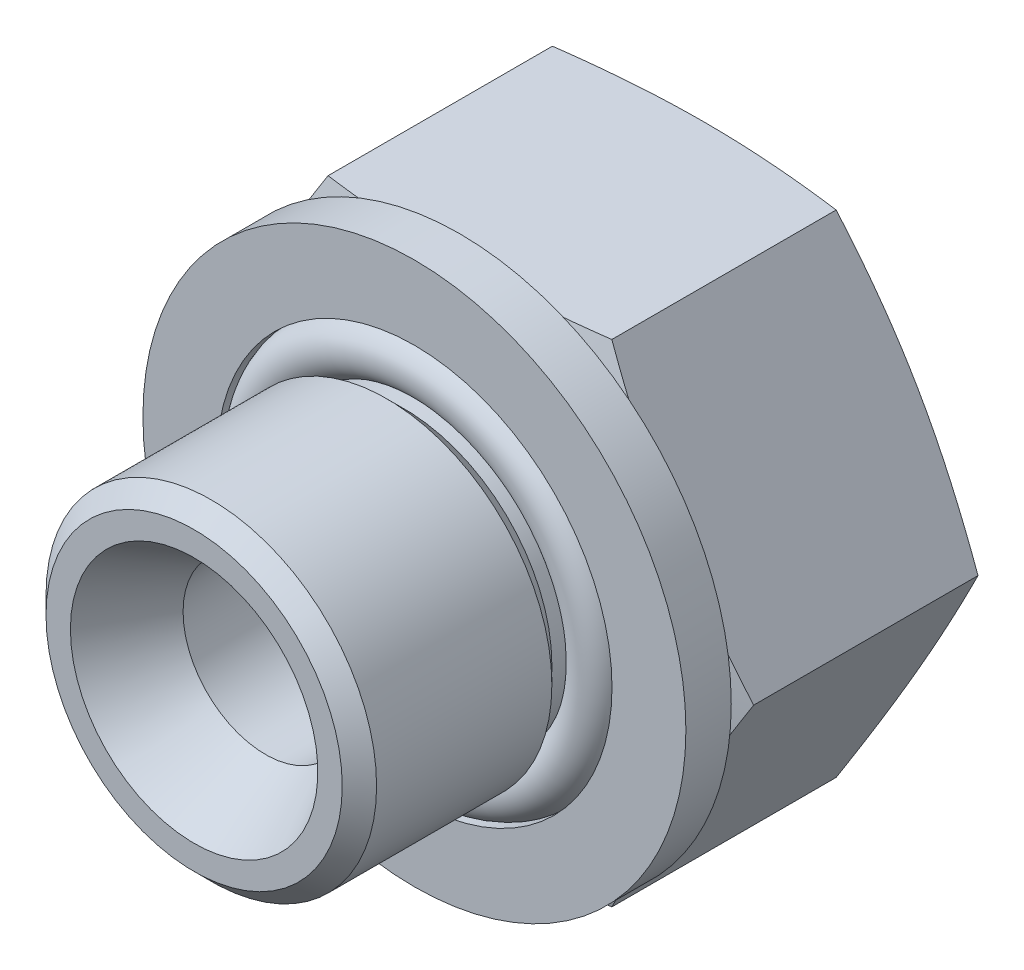
from build123d import *

# Parameters (mm, degrees)
SKETCH2_OUTSIDE_W  = 24.454
SKETCH2_OUTSIDE_H  = 24.454
EXTRUDE2_DEPTH     = 7.12
SKETCH3_W          = 0.76923077
SKETCH3_H          = 0.205128205
CUT_EXTRUDE1_DEPTH = 0.01
SKETCH4_W          = 1.32
SKETCH4_H          = 2.15
SKETCH5_R          = 0.765


with BuildPart() as part:
    # Sketch1 → Revolve1 (revolve)
    with BuildSketch(Plane(origin=(0, 0, 0), x_dir=(0, 0, -1), z_dir=(1, 0, 0)), mode=Mode.PRIVATE) as revolve1_sk:
        Polygon((0, 0), (0, 7.15), (-0.340295474, 8.42), (-6.779704526, 8.42), (-7.12, 7.15), (-7.12, 4.3), (-8.74, 4.3), (-9.25, 4.81), (-14.35, 4.81), (-14.85, 4.31), (-14.85, 3.6), (-12.771539031, 2.4), (-10.292065486, 2.4), (-8.85, 0), align=None)
    revolve(revolve1_sk.sketch.rotate(Axis((0, 0, 0), (0, 0, 1)), 90), axis=Axis((0, 0, 0), (0, 0, 1)))

    # Sketch2 outside → Extrude2 (cut)
    with BuildSketch(Plane(origin=(0, 0, 0), x_dir=(-1, 0, 0), z_dir=(0, 0, -1))):
        Rectangle(SKETCH2_OUTSIDE_W, SKETCH2_OUTSIDE_H)
        Polygon((-4.128054425, 7.15), (-8.256108849, 0), (-4.128054425, -7.15), (4.128054425, -7.15), (8.256108849, 0), (4.128054425, 7.15), align=None, mode=Mode.SUBTRACT)
    extrude(amount=-EXTRUDE2_DEPTH, mode=Mode.SUBTRACT)

    # Sketch3 → Cut-Extrude1 (cut)
    # profile 1 of 6: a face of its own
    with BuildSketch(Plane(origin=(0, 0, 0), x_dir=(-1, 0, 0), z_dir=(0, 0, -1))):
        with BuildLine():
            Line((-4.240655874, 0.385817308), (-4.071585361, 0.487179487))
            add(Edge.make_bspline(
                [(-4.071585361, 0.487179487), (-4.055860654, 0.460856981), (-4.025732722, 0.410424076), (-3.975474803, 0.342276625), (-3.923398853, 0.284355392), (-3.869119234, 0.236997331), (-3.812967264, 0.199712253), (-3.754576376, 0.173310977), (-3.694143341, 0.156844706), (-3.653015443, 0.154844656), (-3.632482797, 0.153846154)],
                knots=[0, 0, 0, 0, 1.272034388, 2.437168799, 3.508375237, 4.49857839, 5.41946034, 6.295179144, 7.148887113, 8, 8, 8, 8], degree=3))
            add(Edge.make_bspline(
                [(-3.632482797, 0.153846154), (-3.614947448, 0.154334538), (-3.580183578, 0.155302761), (-3.529005153, 0.164606077), (-3.479301266, 0.178898722), (-3.43209633, 0.199367825), (-3.388041693, 0.224132674), (-3.349409296, 0.254044776), (-3.316011517, 0.287534036), (-3.288692023, 0.324895553), (-3.267732003, 0.365076781), (-3.251622249, 0.406320182), (-3.242682207, 0.449273649), (-3.241335491, 0.478193914), (-3.240655874, 0.492788462)],
                knots=[0, 0, 0, 0, 1.095163259, 2.171163733, 3.241058638, 4.321873601, 5.38011039, 6.391990106, 7.366004449, 8.327778327, 9.272591725, 10.192022065, 11.087607919, 12, 12, 12, 12], degree=3))
            add(Edge.make_bspline(
                [(-3.240655874, 0.492788462), (-3.241498337, 0.509440376), (-3.243210942, 0.543291284), (-3.257686073, 0.593233943), (-3.280457071, 0.642658268), (-3.301464296, 0.67323042), (-3.312370617, 0.689102564)],
                knots=[0, 0, 0, 0, 0.938893495, 1.908633276, 2.914225137, 4, 4, 4, 4], degree=3))
            add(Edge.make_bspline(
                [(-3.312370617, 0.689102564), (-3.321325254, 0.700557892), (-3.340124394, 0.72460692), (-3.372442972, 0.760404197), (-3.410366466, 0.797329008), (-3.452597069, 0.836791326), (-3.50067312, 0.876955781), (-3.553088842, 0.919737654), (-3.611182476, 0.963509984), (-3.651925045, 0.992865736), (-3.67294754, 1.008012821)],
                knots=[0, 0, 0, 0, 0.722233717, 1.516239348, 2.393582979, 3.351407094, 4.387010283, 5.505090956, 6.712668013, 8, 8, 8, 8], degree=3))
            add(Edge.make_bspline(
                [(-3.67294754, 1.008012821), (-3.693989824, 1.023000585), (-3.734221068, 1.051656049), (-3.790483115, 1.094184211), (-3.840794236, 1.133066422), (-3.884930817, 1.168668715), (-3.922873444, 1.200995918), (-3.954921108, 1.229737597), (-3.980257426, 1.255671061), (-3.994346329, 1.272494685), (-4.000671899, 1.280048077)],
                knots=[0, 0, 0, 0, 1.452282411, 2.77665338, 3.964542531, 5.026858415, 5.96415736, 6.766646006, 7.446254459, 8, 8, 8, 8], degree=3))
            add(Edge.make_bspline(
                [(-4.000671899, 1.280048077), (-4.009513354, 1.291820098), (-4.026901261, 1.314971357), (-4.049853264, 1.35115699), (-4.069361357, 1.388198856), (-4.084654118, 1.426196493), (-4.097531957, 1.464616452), (-4.106193632, 1.503960021), (-4.111617287, 1.544050661), (-4.112172708, 1.571029804), (-4.112450746, 1.584535256)],
                knots=[0, 0, 0, 0, 1.068054152, 2.10047183, 3.106115577, 4.101338837, 5.06977816, 6.043150881, 7.020423561, 8, 8, 8, 8], degree=3))
            add(Edge.make_bspline(
                [(-4.112450746, 1.584535256), (-4.111704912, 1.605695128), (-4.110229186, 1.647562593), (-4.097748891, 1.708723067), (-4.078050094, 1.767115306), (-4.050453015, 1.822161211), (-4.014877385, 1.872427485), (-3.973708257, 1.918492335), (-3.924673122, 1.957217239), (-3.870871623, 1.991052701), (-3.811982267, 2.017536087), (-3.75027318, 2.03751379), (-3.685646281, 2.048833366), (-3.641873062, 2.050457803), (-3.619662284, 2.051282051)],
                knots=[0, 0, 0, 0, 1.005424448, 1.989358655, 2.955360095, 3.929531133, 4.905563448, 5.876582895, 6.856512386, 7.866279853, 8.892233794, 9.918561126, 10.94386622, 12, 12, 12, 12], degree=3))
            add(Edge.make_bspline(
                [(-3.619662284, 2.051282051), (-3.596094227, 2.050469165), (-3.549224883, 2.048852593), (-3.480282474, 2.03479686), (-3.413904922, 2.011539334), (-3.36050877, 1.985145815), (-3.318718621, 1.958785006), (-3.286848488, 1.934773678), (-3.254552802, 1.907130758), (-3.221571056, 1.875782618), (-3.188462108, 1.840441617), (-3.154734421, 1.801349795), (-3.120309125, 1.758746049), (-3.098162919, 1.728332048), (-3.08680972, 1.712740385)],
                knots=[0, 0, 0, 0, 1.286793592, 2.559021753, 3.825965368, 5.121522368, 5.803751409, 6.523245864, 7.299691795, 8.125521123, 9.008227632, 9.944561021, 10.946284179, 12, 12, 12, 12], degree=3))
            Line((-3.08680972, 1.712740385), (-3.249069335, 1.58974359))
            add(Edge.make_bspline(
                [(-3.249069335, 1.58974359), (-3.258867011, 1.602365699), (-3.277735044, 1.626672929), (-3.306380465, 1.660713681), (-3.333379692, 1.691808812), (-3.35997992, 1.718817456), (-3.384776281, 1.743218676), (-3.408843163, 1.764109965), (-3.43183422, 1.78169602), (-3.460815312, 1.800463768), (-3.497225437, 1.819067485), (-3.542930886, 1.834809815), (-3.590694472, 1.84426985), (-3.62322569, 1.845520643), (-3.639694335, 1.846153846)],
                knots=[0, 0, 0, 0, 1.181633172, 2.275549214, 3.290209073, 4.226197932, 5.078386478, 5.862611352, 6.581680152, 7.217281963, 8.414376989, 9.595101626, 10.782541182, 12, 12, 12, 12], degree=3))
            add(Edge.make_bspline(
                [(-3.639694335, 1.846153846), (-3.660355205, 1.845461446), (-3.700197747, 1.844126218), (-3.756763596, 1.829543369), (-3.80767441, 1.806582306), (-3.851418733, 1.774402319), (-3.887839863, 1.736276037), (-3.914185839, 1.692402406), (-3.930043076, 1.643955319), (-3.931978093, 1.610160086), (-3.932963566, 1.592948718)],
                knots=[0, 0, 0, 0, 1.14458467, 2.207223713, 3.21896685, 4.227309161, 5.202851033, 6.127160689, 7.046193047, 8, 8, 8, 8], degree=3))
            add(Edge.make_bspline(
                [(-3.932963566, 1.592948718), (-3.932738922, 1.582233587), (-3.932289267, 1.560785805), (-3.926017954, 1.529099278), (-3.917961195, 1.497492798), (-3.905193977, 1.466108465), (-3.887568089, 1.434397403), (-3.864422274, 1.401813553), (-3.83527181, 1.368069719), (-3.812942089, 1.346122649), (-3.801152669, 1.334535256)],
                knots=[0, 0, 0, 0, 0.858281714, 1.717966888, 2.583508476, 3.4729293, 4.427298488, 5.488583878, 6.674047936, 8, 8, 8, 8], degree=3))
            add(Edge.make_bspline(
                [(-3.801152669, 1.334535256), (-3.796774742, 1.330628385), (-3.786373789, 1.321346551), (-3.767358974, 1.306150962), (-3.742248804, 1.287406521), (-3.711698975, 1.264213769), (-3.675146196, 1.237310076), (-3.63258645, 1.207039441), (-3.584494146, 1.172419178), (-3.550367336, 1.148214869), (-3.53232254, 1.135416667)],
                knots=[0, 0, 0, 0, 0.420754252, 0.999615792, 1.744751191, 2.668019286, 3.750313428, 4.999500688, 6.413464383, 8, 8, 8, 8], degree=3))
            add(Edge.make_bspline(
                [(-3.53232254, 1.135416667), (-3.510616304, 1.119621604), (-3.468585186, 1.089036654), (-3.408780855, 1.043084837), (-3.354555822, 0.998143255), (-3.305719705, 0.954498908), (-3.261790043, 0.912482855), (-3.223254203, 0.871589609), (-3.189719529, 0.832112139), (-3.153617118, 0.781499239), (-3.116726935, 0.719338619), (-3.085046074, 0.643179626), (-3.065069876, 0.566724586), (-3.062457581, 0.515337822), (-3.061168694, 0.489983974)],
                knots=[0, 0, 0, 0, 1.163667725, 2.253281268, 3.268753668, 4.215851969, 5.092017293, 5.902905408, 6.650798638, 7.335211899, 8.59617414, 9.77448103, 10.901945474, 12, 12, 12, 12], degree=3))
            add(Edge.make_bspline(
                [(-3.061168694, 0.489983974), (-3.061544202, 0.47205348), (-3.062287925, 0.436540689), (-3.070837018, 0.384394931), (-3.083362541, 0.33374872), (-3.102240961, 0.285228084), (-3.125282765, 0.237945363), (-3.154520621, 0.193140848), (-3.188410727, 0.149822906), (-3.227287164, 0.109146625), (-3.26982768, 0.071805942), (-3.314789791, 0.038589335), (-3.36224709, 0.010893151), (-3.411942128, -0.011707331), (-3.46388632, -0.029383626), (-3.518062197, -0.04219098), (-3.57455906, -0.050051386), (-3.612959335, -0.05086725), (-3.632482797, -0.051282051)],
                knots=[0, 0, 0, 0, 0.983748083, 1.948392443, 2.894712957, 3.844097841, 4.80183111, 5.778335162, 6.776009319, 7.81870978, 8.863265674, 9.881300176, 10.883814829, 11.87499822, 12.874611388, 13.892143829, 14.928324115, 16, 16, 16, 16], degree=3))
            add(Edge.make_bspline(
                [(-3.632482797, -0.051282051), (-3.647588707, -0.050989948), (-3.677610284, -0.050409419), (-3.722015702, -0.045277258), (-3.765524039, -0.038016056), (-3.807589343, -0.026488016), (-3.848753578, -0.012501172), (-3.888837712, 0.004720732), (-3.927861172, 0.025359133), (-3.966042648, 0.04895629), (-4.003285033, 0.076417858), (-4.039239015, 0.108402713), (-4.075084264, 0.144028716), (-4.109762776, 0.184263324), (-4.143976001, 0.228456514), (-4.177049378, 0.277021761), (-4.209667502, 0.329694535), (-4.230133484, 0.366760298), (-4.240655874, 0.385817308)],
                knots=[0, 0, 0, 0, 0.915332311, 1.819136955, 2.706846663, 3.586547465, 4.459518054, 5.340707479, 6.227863349, 7.133153174, 8.059268498, 9.028702269, 10.047606654, 11.120612155, 12.245963614, 13.433783089, 14.680604001, 16, 16, 16, 16], degree=3))
        make_face()
    # profile 2 of 6: a face of its own
    with BuildSketch(Plane(origin=(0, 0, 0), x_dir=(-1, 0, 0), z_dir=(0, 0, -1))):
        Polygon((-2.702194335, 2), (-1.471425105, 2), (-2.522707156, -0.051282051), (-2.677755233, 0.034054487), (-1.775111002, 1.794871795), (-2.702194335, 1.794871795), align=None)
    # profile 3 of 6: a face of its own
    with BuildSketch(Plane(origin=(0, 0, 0), x_dir=(-1, 0, 0), z_dir=(0, 0, -1))):
        with BuildLine():
            Line((-1.035527669, 1.538461538), (-1.215014848, 1.538461538))
            add(Edge.make_bspline(
                [(-1.215014848, 1.538461538), (-1.210152248, 1.558594386), (-1.200646262, 1.597952458), (-1.180819077, 1.654185178), (-1.159219502, 1.707398619), (-1.133282871, 1.756596375), (-1.104992155, 1.802767177), (-1.072579171, 1.844863819), (-1.037539329, 1.883956942), (-0.998782215, 1.918650221), (-0.958137266, 1.950066066), (-0.915031769, 1.976851813), (-0.870332973, 1.999894186), (-0.823731182, 2.018877176), (-0.775087656, 2.033177475), (-0.724842157, 2.043552793), (-0.672863014, 2.050290572), (-0.637578676, 2.050948151), (-0.619662284, 2.051282051)],
                knots=[0, 0, 0, 0, 1.162005537, 2.271625781, 3.343758855, 4.383309926, 5.390229558, 6.379919256, 7.361854164, 8.333198761, 9.295911338, 10.242430842, 11.177959212, 12.116337295, 13.062827104, 14.020064771, 14.994644689, 16, 16, 16, 16], degree=3))
            add(Edge.make_bspline(
                [(-0.619662284, 2.051282051), (-0.59355786, 2.05049392), (-0.541918425, 2.048934848), (-0.466053827, 2.034698027), (-0.392895645, 2.01216938), (-0.323244646, 1.981041536), (-0.258548399, 1.942648786), (-0.200984863, 1.89695465), (-0.151334286, 1.844840764), (-0.109680356, 1.787279298), (-0.07706607, 1.725761864), (-0.053016714, 1.662447489), (-0.038375754, 1.597486362), (-0.036478293, 1.55362506), (-0.035527669, 1.531650641)],
                knots=[0, 0, 0, 0, 1.083050992, 2.142477498, 3.193116406, 4.255571735, 5.30263384, 6.308962982, 7.297363603, 8.282367274, 9.249857812, 10.179914175, 11.08814088, 12, 12, 12, 12], degree=3))
            add(Edge.make_bspline(
                [(-0.035527669, 1.531650641), (-0.036192578, 1.510503901), (-0.037493702, 1.469123013), (-0.048541534, 1.408710729), (-0.067133684, 1.351772672), (-0.092887834, 1.29806915), (-0.126225863, 1.24794067), (-0.166610261, 1.201274447), (-0.214326068, 1.1578635), (-0.250485461, 1.132995229), (-0.269101387, 1.120192308)],
                knots=[0, 0, 0, 0, 1.024540389, 2.004866551, 2.965041327, 3.920577974, 4.882998113, 5.874504559, 6.905732034, 8, 8, 8, 8], degree=3))
            add(Edge.make_bspline(
                [(-0.269101387, 1.120192308), (-0.247826098, 1.109919067), (-0.205673599, 1.089564805), (-0.148216153, 1.04964723), (-0.096057367, 1.003557888), (-0.066969528, 0.967590658), (-0.052354592, 0.949519231)],
                knots=[0, 0, 0, 0, 1.015518401, 2.012035669, 3.001164323, 4, 4, 4, 4], degree=3))
            add(Edge.make_bspline(
                [(-0.052354592, 0.949519231), (-0.042730967, 0.936343373), (-0.023641313, 0.91020742), (-7.815e-05, 0.868186606), (0.021298486, 0.82570004), (0.037955754, 0.781608951), (0.050855107, 0.736424372), (0.060075697, 0.690068717), (0.065803777, 0.642504133), (0.066624093, 0.610325573), (0.067036434, 0.594150641)],
                knots=[0, 0, 0, 0, 1.025084078, 2.033381695, 3.024893161, 4.013698104, 4.991890475, 5.976764909, 6.982997093, 8, 8, 8, 8], degree=3))
            add(Edge.make_bspline(
                [(0.067036434, 0.594150641), (0.066010998, 0.566145086), (0.063964951, 0.510265771), (0.045676908, 0.427708787), (0.017326485, 0.3470085), (-0.022934621, 0.269822877), (-0.072001769, 0.197605517), (-0.130377383, 0.132990483), (-0.197398188, 0.077448424), (-0.272144273, 0.031042579), (-0.353125489, -0.006053377), (-0.439740113, -0.031800487), (-0.530740144, -0.048569629), (-0.593144314, -0.05036784), (-0.624870617, -0.051282051)],
                knots=[0, 0, 0, 0, 0.955779014, 1.907060117, 2.875433937, 3.871313158, 4.872415639, 5.851225146, 6.836215519, 7.83643374, 8.849228613, 9.86973379, 10.916971861, 12, 12, 12, 12], degree=3))
            add(Edge.make_bspline(
                [(-0.624870617, -0.051282051), (-0.646253075, -0.050785929), (-0.68832662, -0.049809727), (-0.750180048, -0.043136241), (-0.809221019, -0.030947666), (-0.865529361, -0.014545777), (-0.919155096, 0.006249504), (-0.969934585, 0.032145903), (-1.018180238, 0.062609618), (-1.063436781, 0.09800024), (-1.10569882, 0.137589577), (-1.143843234, 0.18208044), (-1.178505973, 0.230650385), (-1.208758909, 0.28386356), (-1.235980025, 0.341032278), (-1.258369143, 0.402888563), (-1.278075182, 0.468879433), (-1.287237162, 0.514866713), (-1.291937925, 0.538461538)],
                knots=[0, 0, 0, 0, 1.048658725, 2.063410685, 3.046034179, 4.001477787, 4.936774919, 5.862367409, 6.792675028, 7.730719943, 8.675894397, 9.627829632, 10.600096036, 11.597688215, 12.626045268, 13.701542398, 14.82072376, 16, 16, 16, 16], degree=3))
            Line((-1.291937925, 0.538461538), (-1.112450746, 0.538461538))
            add(Edge.make_bspline(
                [(-1.112450746, 0.538461538), (-1.107774579, 0.523062102), (-1.098679029, 0.493108861), (-1.083196573, 0.450000115), (-1.06555756, 0.410481228), (-1.046634955, 0.374262301), (-1.026761558, 0.340986642), (-1.004524458, 0.311534146), (-0.98157066, 0.284611173), (-0.964268173, 0.269442823), (-0.955800105, 0.262019231)],
                knots=[0, 0, 0, 0, 1.198163088, 2.33053128, 3.407730985, 4.417276592, 5.372219308, 6.28897303, 7.162600585, 8, 8, 8, 8], degree=3))
            add(Edge.make_bspline(
                [(-0.955800105, 0.262019231), (-0.944602061, 0.253385897), (-0.922240539, 0.236145879), (-0.88580155, 0.214144948), (-0.847478758, 0.195081505), (-0.806441801, 0.180519393), (-0.763576218, 0.168189302), (-0.718189152, 0.160120434), (-0.670681028, 0.154584336), (-0.638242306, 0.154095803), (-0.621665489, 0.153846154)],
                knots=[0, 0, 0, 0, 0.946170439, 1.889420265, 2.845303464, 3.807233317, 4.801018734, 5.828864929, 6.890507805, 8, 8, 8, 8], degree=3))
            add(Edge.make_bspline(
                [(-0.621665489, 0.153846154), (-0.602949202, 0.1541981), (-0.566351118, 0.154886299), (-0.512948341, 0.161215275), (-0.462144085, 0.170432654), (-0.414502414, 0.184668644), (-0.369399267, 0.202257702), (-0.327466895, 0.224342505), (-0.288154835, 0.250253775), (-0.251966603, 0.279704722), (-0.219426313, 0.311945577), (-0.190775163, 0.345667332), (-0.166418213, 0.380727806), (-0.146770454, 0.417321018), (-0.131255854, 0.455295434), (-0.120694025, 0.494757622), (-0.113350302, 0.535384632), (-0.112752238, 0.563001185), (-0.112450746, 0.576923077)],
                knots=[0, 0, 0, 0, 1.217147791, 2.380027433, 3.494444702, 4.572153297, 5.609568379, 6.639424714, 7.649109417, 8.668170816, 9.669597737, 10.625200337, 11.543417969, 12.441394052, 13.322311151, 14.205496177, 15.095365482, 16, 16, 16, 16], degree=3))
            add(Edge.make_bspline(
                [(-0.112450746, 0.576923077), (-0.113325204, 0.595558128), (-0.115069768, 0.632735504), (-0.128388957, 0.687431261), (-0.150296879, 0.740130353), (-0.180966886, 0.789933662), (-0.218301588, 0.83609132), (-0.261938677, 0.877275024), (-0.312240522, 0.911257933), (-0.35853759, 0.934737166), (-0.399546251, 0.950758352), (-0.434640756, 0.96142976), (-0.473930244, 0.970466134), (-0.516939586, 0.978873147), (-0.563992853, 0.986028203), (-0.615038817, 0.991994955), (-0.670087824, 0.996769264), (-0.708197062, 0.998901318), (-0.727835361, 1)],
                knots=[0, 0, 0, 0, 1.07054697, 2.135767047, 3.216561865, 4.33974944, 5.486079747, 6.621378074, 7.775625952, 8.963672916, 9.598146892, 10.304877434, 11.070270905, 11.915000392, 12.823868403, 13.805723172, 14.86925407, 16, 16, 16, 16], degree=3))
            Line((-0.727835361, 1), (-0.727835361, 1.205128205))
            add(Edge.make_bspline(
                [(-0.727835361, 1.205128205), (-0.703091838, 1.205548093), (-0.654625354, 1.20637055), (-0.583828608, 1.216317985), (-0.516129573, 1.230078344), (-0.453028577, 1.251155596), (-0.395515027, 1.275635766), (-0.345618111, 1.304122743), (-0.304036884, 1.335788314), (-0.270973415, 1.371121233), (-0.24609957, 1.409015546), (-0.227912829, 1.448510779), (-0.217169785, 1.4899531), (-0.21573569, 1.518235767), (-0.215014848, 1.532451923)],
                knots=[0, 0, 0, 0, 1.321986639, 2.589447074, 3.816329219, 5.01088745, 6.139805852, 7.153945165, 8.075214402, 8.924034688, 9.728124013, 10.488707548, 11.240355623, 12, 12, 12, 12], degree=3))
            add(Edge.make_bspline(
                [(-0.215014848, 1.532451923), (-0.215251654, 1.542896349), (-0.215722769, 1.563675039), (-0.221664071, 1.594032221), (-0.230592094, 1.623461333), (-0.242866225, 1.651837224), (-0.25929491, 1.678963095), (-0.278955474, 1.705070209), (-0.302365817, 1.730009511), (-0.329191787, 1.753255408), (-0.357998532, 1.775409258), (-0.389569832, 1.79421705), (-0.422953761, 1.810299943), (-0.458187278, 1.823562516), (-0.495384724, 1.833539252), (-0.534371328, 1.84070259), (-0.575221433, 1.845181249), (-0.603090994, 1.845826059), (-0.617258438, 1.846153846)],
                knots=[0, 0, 0, 0, 0.884392785, 1.759457502, 2.611959086, 3.489218968, 4.37281399, 5.2945488, 6.255912374, 7.266815255, 8.301784654, 9.332968512, 10.37626691, 11.440494194, 12.520033166, 13.637162961, 14.798855837, 16, 16, 16, 16], degree=3))
            add(Edge.make_bspline(
                [(-0.617258438, 1.846153846), (-0.64003082, 1.845358782), (-0.684510578, 1.843805837), (-0.748633387, 1.830204115), (-0.808244435, 1.808502353), (-0.853809388, 1.782597771), (-0.887456573, 1.757026094), (-0.911500537, 1.734693302), (-0.935112258, 1.709874546), (-0.956738359, 1.681041188), (-0.978609203, 1.65014588), (-0.998520381, 1.615618062), (-1.017868776, 1.578358408), (-1.029527376, 1.552018045), (-1.035527669, 1.538461538)],
                knots=[0, 0, 0, 0, 1.472543308, 2.876219568, 4.221790263, 5.565193594, 6.249813518, 6.953379497, 7.687249741, 8.463570142, 9.283606569, 10.136032583, 11.040678096, 12, 12, 12, 12], degree=3))
        make_face()
    # profile 4 of 6: a face of its own
    with BuildSketch(Plane(origin=(0, 0, 0), x_dir=(-1, 0, 0), z_dir=(0, 0, -1))):
        with Locations((0.631138998, 0.76923077)):
            Rectangle(SKETCH3_W, SKETCH3_H)
    # profile 5 of 6: a face of its own
    with BuildSketch(Plane(origin=(0, 0, 0), x_dir=(-1, 0, 0), z_dir=(0, 0, -1))):
        with BuildLine():
            add(Edge.make_bspline(
                [(1.169600537, 0.999198718), (1.169787975, 1.031254368), (1.170152078, 1.093522931), (1.174202605, 1.184257012), (1.180931372, 1.269377177), (1.190152728, 1.3488875), (1.20137443, 1.422808509), (1.216354709, 1.490942656), (1.233390596, 1.553605288), (1.253134851, 1.611000744), (1.275413587, 1.663902289), (1.299661736, 1.713288118), (1.326841619, 1.759083508), (1.355399855, 1.802019388), (1.386492467, 1.841392928), (1.419234633, 1.877760164), (1.454904276, 1.910280593), (1.492288853, 1.939907051), (1.531726832, 1.965878178), (1.57209407, 1.988754028), (1.613668416, 2.00829681), (1.656563378, 2.023662773), (1.700393411, 2.036354686), (1.745311735, 2.045034084), (1.791392514, 2.050495175), (1.822496191, 2.051017271), (1.838270408, 2.051282051)],
                knots=[0, 0, 0, 0, 1.646270934, 3.197905019, 4.663502075, 6.030701355, 7.308322542, 8.50163776, 9.611534131, 10.641858119, 11.616356847, 12.558055219, 13.465016945, 14.349605745, 15.204443733, 16.039544428, 16.859896111, 17.680448484, 18.487036065, 19.28249412, 20.06191084, 20.843045899, 21.620316918, 22.403196591, 23.190181807, 24, 24, 24, 24], degree=3))
            add(Edge.make_bspline(
                [(1.838270408, 2.051282051), (1.854176396, 2.0510033), (1.885808401, 2.050448951), (1.93257433, 2.045120984), (1.978259862, 2.036280342), (2.022670227, 2.023754071), (2.066170219, 2.008213684), (2.108419595, 1.988735331), (2.149680785, 1.966061693), (2.189298092, 1.939419477), (2.227706444, 1.909715319), (2.263962422, 1.876136651), (2.298069329, 1.839022526), (2.330455217, 1.798770032), (2.360201273, 1.754607127), (2.388528949, 1.707301921), (2.413884398, 1.656027141), (2.438304212, 1.601638303), (2.45938249, 1.542630498), (2.478391773, 1.479336349), (2.493751184, 1.411008242), (2.506545054, 1.338004673), (2.516456423, 1.26005754), (2.523675075, 1.177333931), (2.527488267, 1.089779422), (2.528206382, 1.029917794), (2.528574895, 0.999198718)],
                knots=[0, 0, 0, 0, 0.810914788, 1.612654377, 2.396697861, 3.181598691, 3.963628158, 4.749916497, 5.551656086, 6.361998678, 7.18212741, 8.025565596, 8.878627764, 9.750805457, 10.657531673, 11.591944965, 12.560506719, 13.57287815, 14.630710178, 15.753379473, 16.941251878, 18.199788006, 19.531962791, 20.947069417, 22.433333509, 24, 24, 24, 24], degree=3))
            add(Edge.make_bspline(
                [(2.528574895, 0.999198718), (2.528202561, 0.968613628), (2.527477084, 0.909019827), (2.523717823, 0.821859269), (2.516312891, 0.739574673), (2.50705004, 0.661968695), (2.494220919, 0.589364341), (2.478446538, 0.52151037), (2.460932068, 0.458113758), (2.439312185, 0.399693866), (2.415648922, 0.345435738), (2.389903096, 0.294768796), (2.362320338, 0.247245201), (2.332269627, 0.203245345), (2.300239105, 0.162457541), (2.265543225, 0.125601757), (2.229160034, 0.091789944), (2.190638654, 0.0617033), (2.150403481, 0.035369126), (2.109284009, 0.011818354), (2.066550647, -0.007171757), (2.023171817, -0.023477495), (1.978527036, -0.035934896), (1.932671956, -0.044548528), (1.885839821, -0.050589584), (1.854181784, -0.05105043), (1.838270408, -0.051282051)],
                knots=[0, 0, 0, 0, 1.561518951, 3.042555995, 4.452378317, 5.7783523, 7.031515105, 8.214008947, 9.334062868, 10.386615937, 11.391082383, 12.354592575, 13.286541444, 14.194233754, 15.072674879, 15.931287219, 16.775624067, 17.606195743, 18.42308326, 19.229000347, 20.022332153, 20.807536673, 21.593273796, 22.3848459, 23.188221202, 24, 24, 24, 24], degree=3))
            add(Edge.make_bspline(
                [(1.838270408, -0.051282051), (1.822496629, -0.051015562), (1.791393815, -0.050490098), (1.745306714, -0.04505368), (1.70057389, -0.036313393), (1.656974602, -0.024075333), (1.614285164, -0.009095427), (1.573087286, 0.010420964), (1.532922896, 0.032897574), (1.493899149, 0.058494958), (1.456749343, 0.087821634), (1.421264426, 0.120258371), (1.388335843, 0.156614606), (1.357687789, 0.196316276), (1.328559738, 0.238998129), (1.301765811, 0.285242913), (1.276982466, 0.334867262), (1.254329042, 0.388191783), (1.234244092, 0.445994599), (1.216502544, 0.508936986), (1.202494454, 0.577574493), (1.190504194, 0.651355845), (1.180833118, 0.730598091), (1.174230646, 0.81534425), (1.170149895, 0.905541512), (1.169786998, 0.967409955), (1.169600537, 0.999198718)],
                knots=[0, 0, 0, 0, 0.810891512, 1.598919785, 2.382837074, 3.152667961, 3.926044502, 4.706494248, 5.493654104, 6.291793342, 7.103789334, 7.925228297, 8.761435821, 9.622817696, 10.50288917, 11.416980706, 12.369136599, 13.353924996, 14.394355917, 15.514179734, 16.714354668, 17.994756427, 19.357759367, 20.818452758, 22.365282078, 24, 24, 24, 24], degree=3))
        make_face()
        with BuildLine():
            add(Edge.make_bspline(
                [(1.349087716, 1), (1.349155971, 0.973286458), (1.349288442, 0.921440718), (1.352749128, 0.846101712), (1.357463546, 0.775832952), (1.363544287, 0.710545217), (1.372574544, 0.650459496), (1.382692708, 0.595162534), (1.395005902, 0.54494697), (1.409574484, 0.499468221), (1.426168254, 0.457954468), (1.44428589, 0.419325202), (1.46374916, 0.383124095), (1.485531532, 0.349676319), (1.509254425, 0.318872797), (1.534382002, 0.290168321), (1.56185205, 0.264570046), (1.599854189, 0.233868986), (1.650023603, 0.202143767), (1.713235291, 0.17451743), (1.778188692, 0.157156026), (1.82227512, 0.154948165), (1.844280024, 0.153846154)],
                knots=[0, 0, 0, 0, 1.459021318, 2.831673884, 4.118529203, 5.306027144, 6.411944654, 7.436330062, 8.375795394, 9.233974572, 10.042671642, 10.816086306, 11.563610507, 12.285937304, 12.993564865, 13.685989202, 14.367179055, 15.041617293, 16.353048772, 17.594441528, 18.799311195, 20, 20, 20, 20], degree=3))
            add(Edge.make_bspline(
                [(1.844280024, 0.153846154), (1.866427265, 0.154759171), (1.910676021, 0.156583322), (1.975323904, 0.1741826), (2.038084058, 0.200736623), (2.087268024, 0.232135197), (2.12468662, 0.2620371), (2.151496329, 0.287531184), (2.176103214, 0.316077394), (2.199441542, 0.346876992), (2.220846728, 0.380518412), (2.240311378, 0.416839883), (2.258073291, 0.455942271), (2.268192746, 0.483239264), (2.273366562, 0.497195513)],
                knots=[0, 0, 0, 0, 1.353760809, 2.704726607, 4.075137775, 5.516104923, 6.260822281, 7.007110065, 7.778089737, 8.566572457, 9.372053459, 10.217411131, 11.088608312, 12, 12, 12, 12], degree=3))
            add(Edge.make_bspline(
                [(2.273366562, 0.497195513), (2.279396144, 0.515041078), (2.29163878, 0.551275229), (2.307416937, 0.60748303), (2.319842879, 0.666456038), (2.331021945, 0.727841819), (2.338652263, 0.792093077), (2.344793871, 0.859011011), (2.348411406, 0.928646075), (2.348859835, 0.975957498), (2.349087716, 1)],
                knots=[0, 0, 0, 0, 0.884706709, 1.796334032, 2.740027952, 3.714592787, 4.726048262, 5.777819803, 6.87074269, 8, 8, 8, 8], degree=3))
            add(Edge.make_bspline(
                [(2.349087716, 1), (2.348773322, 1.024038613), (2.348158301, 1.071063278), (2.34580745, 1.13993081), (2.339736836, 1.205340959), (2.332994483, 1.267575515), (2.323053214, 1.326289974), (2.312334467, 1.381975863), (2.297933774, 1.433943305), (2.282551046, 1.483005923), (2.264945105, 1.528606297), (2.245564686, 1.570957033), (2.224866538, 1.61026259), (2.202385258, 1.646415128), (2.178387724, 1.679576581), (2.152240553, 1.709082063), (2.124980912, 1.735846045), (2.086799663, 1.766396085), (2.036814354, 1.797545625), (1.974616842, 1.826211773), (1.909890759, 1.842673655), (1.8661345, 1.844994619), (1.844280024, 1.846153846)],
                knots=[0, 0, 0, 0, 1.31362396, 2.569729283, 3.763502607, 4.902122613, 5.988968491, 7.01645872, 7.998833611, 8.933434873, 9.825090667, 10.667526885, 11.477055099, 12.250526234, 12.991942729, 13.710640831, 14.402115721, 15.076753259, 16.378508321, 17.609869233, 18.806226677, 20, 20, 20, 20], degree=3))
            add(Edge.make_bspline(
                [(1.844280024, 1.846153846), (1.822159685, 1.844993019), (1.777878711, 1.842669251), (1.712479879, 1.826273107), (1.649791679, 1.797694269), (1.59993855, 1.766292913), (1.561730672, 1.736385307), (1.534826276, 1.71045019), (1.509599892, 1.682080902), (1.486361206, 1.650994093), (1.464595901, 1.617585312), (1.444606751, 1.581591732), (1.426596849, 1.542830953), (1.409977114, 1.501335847), (1.395364092, 1.455861021), (1.383310399, 1.405707311), (1.37217494, 1.35058623), (1.364291929, 1.290175082), (1.357284068, 1.224870995), (1.352780441, 1.154426813), (1.349276865, 1.078961452), (1.349152029, 1.026847648), (1.349087716, 1)],
                knots=[0, 0, 0, 0, 1.207732386, 2.417664972, 3.655092373, 4.956220595, 5.625982001, 6.301752483, 6.994047911, 7.697131622, 8.419323945, 9.170223765, 9.943494443, 10.752040957, 11.610060368, 12.549350801, 13.567764191, 14.679664412, 15.874934091, 17.154273443, 18.533957287, 20, 20, 20, 20], degree=3))
        make_face(mode=Mode.SUBTRACT)
    # profile 6 of 6: a face of its own
    with BuildSketch(Plane(origin=(0, 0, 0), x_dir=(-1, 0, 0), z_dir=(0, 0, -1))):
        with BuildLine():
            Line((2.964472331, 1.384615385), (2.784985152, 1.384615385))
            add(Edge.make_bspline(
                [(2.784985152, 1.384615385), (2.786154954, 1.40842732), (2.788452413, 1.455193329), (2.799211435, 1.523378418), (2.814606222, 1.588552589), (2.836372768, 1.65019254), (2.863404926, 1.708843287), (2.895822085, 1.764271867), (2.934218571, 1.816266832), (2.977765276, 1.864346171), (3.025061641, 1.908453354), (3.076093607, 1.946542065), (3.129719336, 1.978723591), (3.185776136, 2.005627158), (3.244896458, 2.025821356), (3.306543805, 2.04080515), (3.370989026, 2.049820204), (3.41489761, 2.050789225), (3.437228742, 2.051282051)],
                knots=[0, 0, 0, 0, 1.10065271, 2.161652631, 3.183658789, 4.190468796, 5.17591951, 6.163126047, 7.15150782, 8.156236427, 9.156009102, 10.134482811, 11.092018607, 12.041330605, 13.001268258, 13.972401359, 14.968799086, 16, 16, 16, 16], degree=3))
            add(Edge.make_bspline(
                [(3.437228742, 2.051282051), (3.45915907, 2.050768648), (3.502251381, 2.049759828), (3.565143961, 2.041096382), (3.6250167, 2.027527473), (3.681752567, 2.008490092), (3.734898889, 1.982898991), (3.784854915, 1.95215754), (3.832215378, 1.916603351), (3.874847826, 1.874744029), (3.9139953, 1.830056952), (3.947768017, 1.782349578), (3.976689825, 1.733075701), (4.00079707, 1.681859586), (4.018543436, 1.628218998), (4.032016697, 1.572934882), (4.039632362, 1.51543499), (4.040801176, 1.476516958), (4.041395408, 1.456730769)],
                knots=[0, 0, 0, 0, 1.111607364, 2.184268762, 3.212621178, 4.221274766, 5.211760367, 6.196651075, 7.1921475, 8.207485113, 9.220403448, 10.201281604, 11.166441695, 12.114753415, 13.065576456, 14.026450734, 14.996634279, 16, 16, 16, 16], degree=3))
            add(Edge.make_bspline(
                [(4.041395408, 1.456730769), (4.04042783, 1.428874864), (4.038509652, 1.373651885), (4.022101436, 1.292500534), (3.996474859, 1.213875723), (3.965619226, 1.150597265), (3.934492115, 1.099606697), (3.906442111, 1.05762458), (3.873605076, 1.012421455), (3.835503077, 0.964148691), (3.792924293, 0.912428174), (3.745483057, 0.857291148), (3.692841067, 0.79930728), (3.655893353, 0.759704079), (3.636747972, 0.739182692)],
                knots=[0, 0, 0, 0, 1.184426356, 2.348067706, 3.509069118, 4.696110526, 5.333549288, 6.050745305, 6.844228056, 7.710549037, 8.667450064, 9.695053472, 10.805634456, 12, 12, 12, 12], degree=3))
            Line((3.636747972, 0.739182692), (3.136347331, 0.205128205))
            Line((3.136347331, 0.205128205), (4.067036434, 0.205128205))
            Line((4.067036434, 0.205128205), (4.067036434, 0))
            Line((4.067036434, 0), (2.708062075, 0))
            Line((2.708062075, 0), (3.483703101, 0.827724359))
            add(Edge.make_bspline(
                [(3.483703101, 0.827724359), (3.502587607, 0.847437677), (3.53886088, 0.885302926), (3.59016521, 0.940584618), (3.636244631, 0.99187007), (3.677397427, 1.039062383), (3.712730859, 1.082851851), (3.74408642, 1.121820253), (3.769209615, 1.157679939), (3.796475555, 1.199246004), (3.822883545, 1.249995899), (3.84557632, 1.31201515), (3.859413376, 1.375859295), (3.861073282, 1.419003316), (3.861908229, 1.440705128)],
                knots=[0, 0, 0, 0, 1.329631726, 2.553950428, 3.673215718, 4.687767853, 5.603093632, 6.413772471, 7.123043292, 7.734684054, 8.834405432, 9.900288307, 10.943827018, 12, 12, 12, 12], degree=3))
            add(Edge.make_bspline(
                [(3.861908229, 1.440705128), (3.861544947, 1.454351642), (3.86082899, 1.481246299), (3.854510306, 1.520678161), (3.844961445, 1.558715198), (3.83127844, 1.595474409), (3.813217446, 1.63058621), (3.791232657, 1.664093341), (3.765866907, 1.696487036), (3.736523324, 1.726860349), (3.70428817, 1.754678181), (3.670234313, 1.779320515), (3.634205682, 1.799914293), (3.596354184, 1.816796291), (3.556785344, 1.830039366), (3.515422633, 1.839215697), (3.472380338, 1.844977117), (3.442989769, 1.845756643), (3.428013998, 1.846153846)],
                knots=[0, 0, 0, 0, 0.991446411, 1.95395049, 2.89581595, 3.838931463, 4.798493298, 5.75982156, 6.748411868, 7.785213223, 8.824556874, 9.840280684, 10.836137867, 11.835679398, 12.848801643, 13.863922112, 14.911575587, 16, 16, 16, 16], degree=3))
            add(Edge.make_bspline(
                [(3.428013998, 1.846153846), (3.412373522, 1.845745256), (3.38165821, 1.844942853), (3.33656162, 1.839329902), (3.293541176, 1.829646565), (3.25248866, 1.816402751), (3.21333461, 1.799569295), (3.176269442, 1.778602583), (3.141376363, 1.753583444), (3.108589778, 1.725217412), (3.07838179, 1.693635926), (3.051840718, 1.658430233), (3.028649853, 1.620243138), (3.008416005, 1.579177681), (2.991984182, 1.534861235), (2.979428096, 1.487451118), (2.969492755, 1.437153186), (2.966173601, 1.402418851), (2.964472331, 1.384615385)],
                knots=[0, 0, 0, 0, 1.031018746, 2.02475058, 2.990194455, 3.934040569, 4.864654155, 5.795059489, 6.735614925, 7.690564532, 8.649604399, 9.611025574, 10.590972636, 11.591080095, 12.624614302, 13.701020113, 14.821632451, 16, 16, 16, 16], degree=3))
        make_face()
    extrude(amount=-CUT_EXTRUDE1_DEPTH, mode=Mode.SUBTRACT)

    # Sketch4 → Revolve2 (revolve)
    with BuildSketch(Plane(origin=(0, 0, 0), x_dir=(0, 0, -1), z_dir=(1, 0, 0)), mode=Mode.PRIVATE) as revolve2_sk:
        with Locations((-7.78, 6.825)):
            Rectangle(SKETCH4_W, SKETCH4_H)
    revolve(revolve2_sk.sketch.rotate(Axis((0, 0, 0), (0, 0, 1)), 90), axis=Axis((0, 0, 0), (0, 0, 1)))

    # Sketch5 → Revolve3 (revolve)
    with BuildSketch(Plane(origin=(0, 0, 0), x_dir=(0, 0, -1), z_dir=(1, 0, 0)), mode=Mode.PRIVATE) as revolve3_sk:
        with Locations((-7.94, 5)):
            Circle(SKETCH5_R)
    revolve(revolve3_sk.sketch.rotate(Axis((0, 0, 0), (0, 0, 1)), 90), axis=Axis((0, 0, 0), (0, 0, 1)))


solid = part.part
